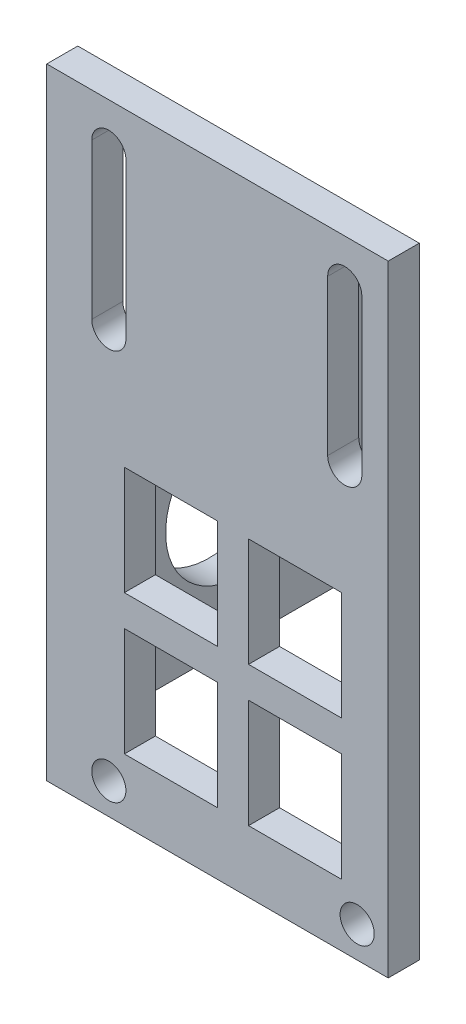
from build123d import *

# Parameters (mm, degrees)
SKETCH2_W           = 42.3
SKETCH2_H           = 42.3
SKETCH2_R           = 1.5
SKETCH2_R_2         = 12
BOSS_EXTRUDE1_DEPTH = 5
SKETCH3_W           = 55
SKETCH3_H           = 100
SKETCH3_R           = 2.75
SKETCH3_W_2         = 15
SKETCH3_H_2         = 17.5
BOSS_EXTRUDE2_DEPTH = 5
FILLET1_R           = 5


with BuildPart() as part:
    # Sketch2 → Boss-Extrude1 (new body)
    with BuildSketch(Plane(origin=(0, 0, 0), x_dir=(0, 0, -1), z_dir=(1, 0, 0))):
        Rectangle(SKETCH2_W, SKETCH2_H)
        with Locations((-15.5, 15.5)):
            Circle(SKETCH2_R, mode=Mode.SUBTRACT)
        with Locations((15.5, 15.5)):
            Circle(SKETCH2_R, mode=Mode.SUBTRACT)
        with Locations((15.5, -15.5)):
            Circle(SKETCH2_R, mode=Mode.SUBTRACT)
        with Locations((-15.5, -15.5)):
            Circle(SKETCH2_R, mode=Mode.SUBTRACT)
        Circle(SKETCH2_R_2, mode=Mode.SUBTRACT)
    extrude(amount=BOSS_EXTRUDE1_DEPTH)

    # Sketch3 → Boss-Extrude2 (add)
    with BuildSketch(Plane.XY.offset(21.15)):
        with Locations((27.5, 20)):
            Rectangle(SKETCH3_W, SKETCH3_H)
        with Locations((50, -25)):
            Circle(SKETCH3_R, mode=Mode.SUBTRACT)
        with Locations((10, -25)):
            Circle(SKETCH3_R, mode=Mode.SUBTRACT)
        with Locations((20, 11.25)):
            Rectangle(SKETCH3_W_2, SKETCH3_H_2, mode=Mode.SUBTRACT)
        with Locations((40, 11.25)):
            Rectangle(SKETCH3_W_2, SKETCH3_H_2, mode=Mode.SUBTRACT)
        with Locations((40, -11.25)):
            Rectangle(SKETCH3_W_2, SKETCH3_H_2, mode=Mode.SUBTRACT)
        with Locations((20, -11.25)):
            Rectangle(SKETCH3_W_2, SKETCH3_H_2, mode=Mode.SUBTRACT)
        with BuildLine():
            Line((50.75, 63), (50.75, 38))
            ThreePointArc((50.75, 38), (48, 35.25), (45.25, 38))
            Line((45.25, 38), (45.25, 63))
            ThreePointArc((45.25, 63), (48, 65.75), (50.75, 63))
        make_face(mode=Mode.SUBTRACT)
        with BuildLine():
            Line((12.75, 63), (12.75, 38))
            ThreePointArc((12.75, 38), (10, 35.25), (7.25, 38))
            Line((7.25, 38), (7.25, 63))
            ThreePointArc((7.25, 63), (10, 65.75), (12.75, 63))
        make_face(mode=Mode.SUBTRACT)
    extrude(amount=BOSS_EXTRUDE2_DEPTH)

    # Fillet1
    fillet1_edges = [part.edges().sort_by_distance(p)[0] for p in [
        (2.5, -21.15, 21.15),
        (2.5, 21.15, 21.15),
    ]]
    fillet(fillet1_edges, radius=FILLET1_R)


solid = part.part
